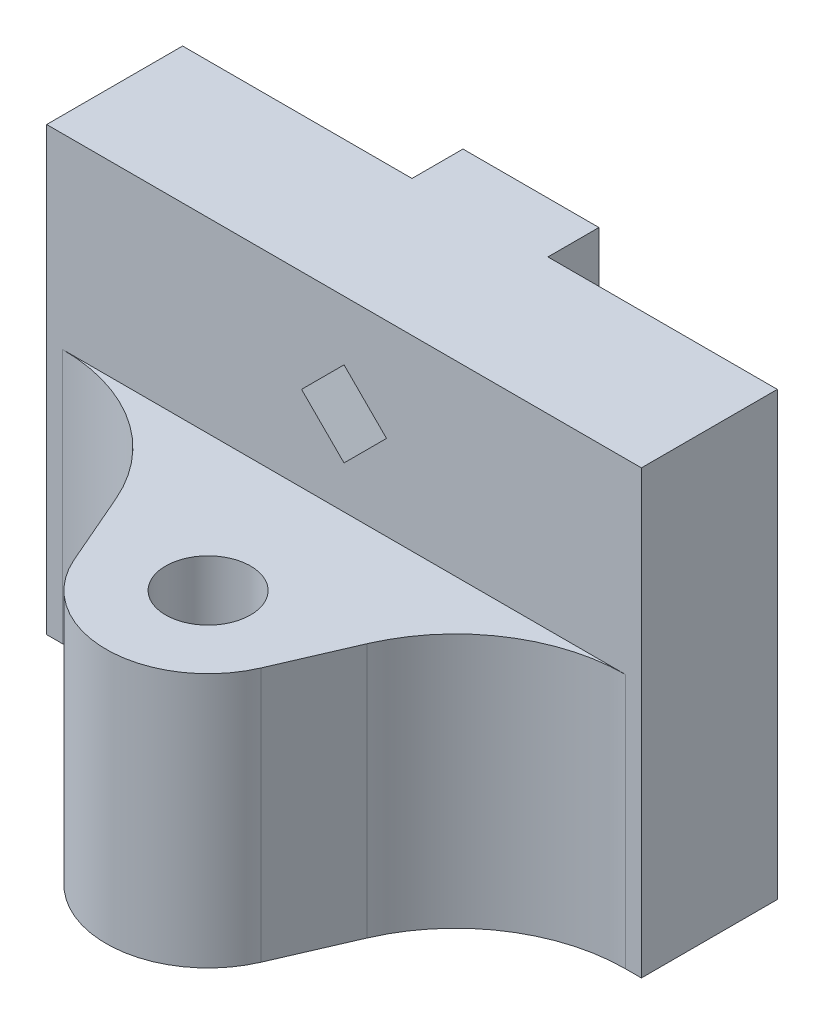
from build123d import *

# Parameters (mm, degrees)
SKIZZE1_W                       = 35
SKIZZE1_H                       = 26
AUFSATZ_LINEAR_AUSTRAGEN1_DEPTH = 8
AUFSATZ_LINEAR_AUSTRAGEN2_DEPTH = 3
SKIZZE3_R                       = 2.5
AUFSATZ_LINEAR_AUSTRAGEN3_DEPTH = 15
VERRUNDUNG1_R                   = 10


with BuildPart() as part:
    # Skizze1 → Aufsatz-Linear austragen1 (new body)
    with BuildSketch(Plane.XY):
        with Locations((0, -7)):
            Rectangle(SKIZZE1_W, SKIZZE1_H)
        Polygon((0, 2.5), (-2.5, 0), (0, -2.5), (2.5, 0), align=None, mode=Mode.SUBTRACT)
    extrude(amount=AUFSATZ_LINEAR_AUSTRAGEN1_DEPTH)

    # Skizze2 → Aufsatz-Linear austragen2 (add)
    with BuildSketch(Plane(origin=(0, 0, 0), x_dir=(-1, 0, 0), z_dir=(0, 0, -1))):
        Polygon((0, 6), (-4, 6), (-4, -20), (0, -20), (4, -20), (4, 6), align=None)
        Polygon((-2.5, 0), (0, -2.5), (2.5, 0), (0, 2.5), align=None, mode=Mode.SUBTRACT)
    extrude(amount=AUFSATZ_LINEAR_AUSTRAGEN2_DEPTH)

    # Skizze3 → Aufsatz-Linear austragen3 (add)
    with BuildSketch(Plane.XZ.offset(20)):
        with BuildLine():
            Line((0, 8), (-10, 8))
            Line((-10, 8), (-5.506451268, 18.383064085))
            ThreePointArc((-5.506451268, 18.383064085), (0, 22), (5.506451268, 18.383064085))
            Line((5.506451268, 18.383064085), (10, 8))
            Line((10, 8), (0, 8))
        make_face()
        with Locations((0, 16)):
            Circle(SKIZZE3_R, mode=Mode.SUBTRACT)
    extrude(amount=-AUFSATZ_LINEAR_AUSTRAGEN3_DEPTH)

    # Verrundung1
    verrundung1_edges = [part.edges().sort_by_distance(p)[0] for p in [
        (10, -12.5, 8),
        (-10, -12.5, 8),
    ]]
    fillet(verrundung1_edges, radius=VERRUNDUNG1_R)


solid = part.part
